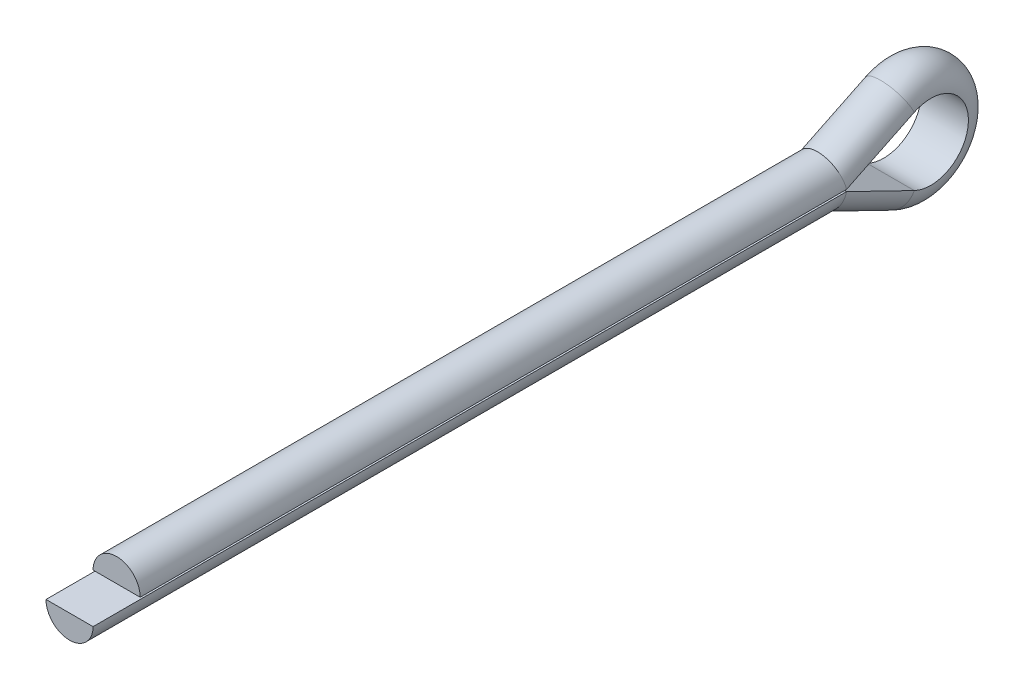
from build123d import *


with BuildPart() as part:
    # Sweep2: sweep along a path in Sketch2
    with BuildLine(Plane(origin=(0, 0, 0), x_dir=(0, 0, -1), z_dir=(1, 0, 0))) as sweep2_path:
        Line((3.175, 0), (50.8, 0))
        Line((50.8, 0), (55.368806141, 2.22090307))
        ThreePointArc((55.368806141, 2.22090307), (59.019257676, -0.0635), (55.368806141, -2.34790307))
        Line((55.368806141, -2.34790307), (50.8, -0.127))
        Line((50.8, -0.127), (0, -0.127))
    # Sketch3 → Sweep2 (sweep)
    with BuildSketch(Plane.XY.offset(-3.175)):
        with BuildLine():
            Line((-1.5875, 0), (1.5875, 0))
            ThreePointArc((1.5875, 0), (0, 1.5875), (-1.5875, 0))
        make_face()
    sweep(path=sweep2_path.line, transition=Transition.RIGHT)


solid = part.part
